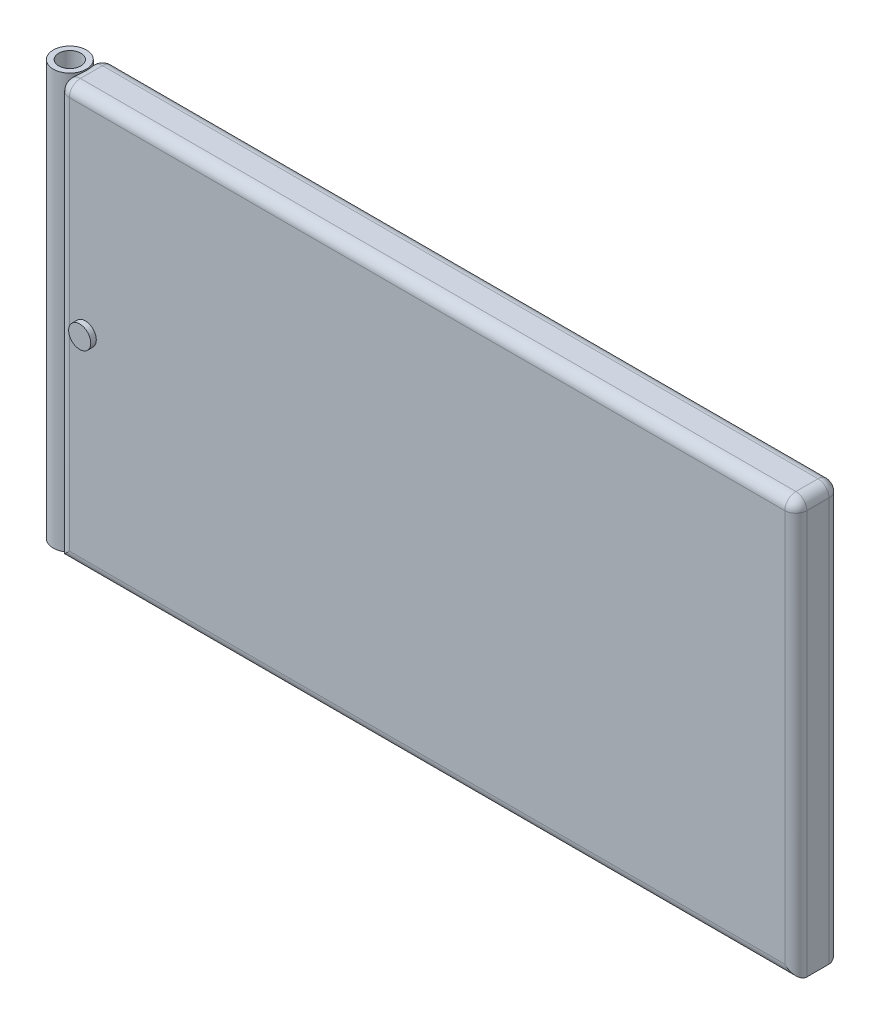
from build123d import *

# Parameters (mm, degrees)
SKETCH1_W           = 1333.4
SKETCH1_H           = 750
BOSS_EXTRUDE1_DEPTH = 80
FILLET1_R           = 20
FILLET2_R           = 20
SKETCH2_R           = 30
SKETCH2_R_2         = 20
BOSS_EXTRUDE2_DEPTH = 750
SKETCH3_R           = 20
CUT_EXTRUDE1_DEPTH  = 750
SKETCH4_R           = 20
BOSS_EXTRUDE3_DEPTH = 10


with BuildPart() as part:
    # Sketch1 → Boss-Extrude1 (new body)
    with BuildSketch(Plane.XY):
        with Locations((-190.485714286, -135.702321429)):
            Rectangle(SKETCH1_W, SKETCH1_H)
    extrude(amount=BOSS_EXTRUDE1_DEPTH)

    # Fillet1
    fillet1_edges = [part.edges().sort_by_distance(p)[0] for p in [
        (-190.485714286, 239.297678571, 0),
    ]]
    fillet(fillet1_edges, radius=FILLET1_R)

    # Fillet2
    fillet2_edges = [part.edges().sort_by_distance(p)[0] for p in [
        (476.214285714, -135.702321429, 80),
        (-857.185714286, -145.702321429, 0),
        (-190.485714286, 239.297678571, 80),
        (476.214285714, 233.439814195, 5.857864376),
        (-857.185714286, 233.439814195, 5.857864376),
        (-857.185714286, -135.702321429, 80),
        (476.214285714, -145.702321429, 0),
        (-190.485714286, -510.702321429, 0),
        (-857.185714286, 239.297678571, 50),
        (476.214285714, 239.297678571, 50),
        (-190.485714286, -510.702321429, 80),
    ]]
    fillet(fillet2_edges, radius=FILLET2_R)

    # Sketch2 → Boss-Extrude2 (add)
    with BuildSketch(Plane(origin=(0, 239.297678571, 0), x_dir=(1, 0, 0), z_dir=(0, 1, 0))):
        with Locations(Location((-876.240324271, -40, 0), (0, 0, 270))):
            Circle(SKETCH2_R)
        with Locations(Location((-876.240324271, -40, 0), (0, 0, 270))):
            Circle(SKETCH2_R_2, mode=Mode.SUBTRACT)
    extrude(amount=-BOSS_EXTRUDE2_DEPTH)

    # Sketch3 → Cut-Extrude1 (cut)
    with BuildSketch(Plane(origin=(0, 239.297678571, 0), x_dir=(1, 0, 0), z_dir=(0, 1, 0))):
        with Locations(Location((-876.240324271, -40, 0), (0, 0, 270))):
            Circle(SKETCH3_R)
    extrude(amount=-CUT_EXTRUDE1_DEPTH, mode=Mode.SUBTRACT)

    # Sketch4 → Boss-Extrude3 (add)
    with BuildSketch(Plane.XY.offset(80)):
        with Locations((-808.393239531, -135.702321429)):
            Circle(SKETCH4_R)
    extrude(amount=BOSS_EXTRUDE3_DEPTH)


solid = part.part
